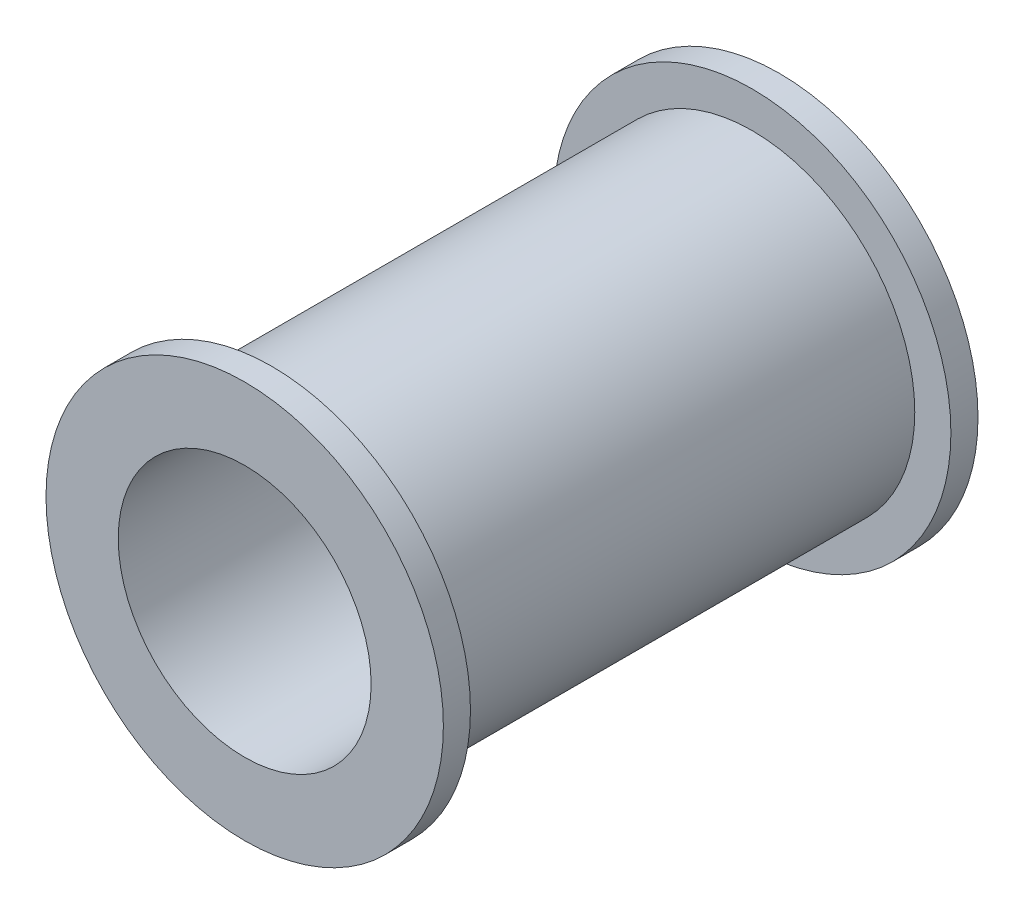
from build123d import *

# Parameters (mm, degrees)
CROQUIS1_R                 = 9
CROQUIS1_R_2               = 1.625
SALIENTE_EXTRUIR1_DEPTH    = 8.9
SALIENTE_EXTRUIR2_START    = 20.7
CROQUIS2_R                 = 9
CROQUIS2_R_2               = 7
SALIENTE_EXTRUIR2_DEPTH    = 20.7
CORTAR_EXTRUIR1_DEPTH      = 6.25
CORTAR_EXTRUIR2_DEPTH      = 7.25
CORTAR_EXTRUIR2_DEPTH_BACK = 4.25
CROQUIS4_R                 = 1.625
CROQUIS7_R                 = 11
CROQUIS7_R_2               = 7
SALIENTE_EXTRUIR3_DEPTH    = 1.5
SALIENTE_EXTRUIR4_START    = -1.5
CROQUIS8_R                 = 11
CROQUIS8_R_2               = 9
SALIENTE_EXTRUIR4_DEPTH    = 1.5


with BuildPart() as part:
    # Croquis1 → Saliente-Extruir1 (new body)
    with BuildSketch(Plane.XY):
        with Locations((-4.976335362, -25.8)):
            Circle(CROQUIS1_R)
        with Locations((-4.976335362, -25.8)):
            Circle(CROQUIS1_R_2, mode=Mode.SUBTRACT)
    extrude(amount=-SALIENTE_EXTRUIR1_DEPTH)

    # Croquis2 → Saliente-Extruir2 (add)
    with BuildSketch(Plane.XY.offset(SALIENTE_EXTRUIR2_START)):
        with Locations((-4.976335362, -25.8)):
            Circle(CROQUIS2_R)
        with Locations((-4.976335362, -25.8)):
            Circle(CROQUIS2_R_2, mode=Mode.SUBTRACT)
    extrude(amount=-SALIENTE_EXTRUIR2_DEPTH)

    # Croquis3 → Cortar-Extruir1 (cut)
    with BuildSketch(Plane(origin=(0, 0, -8.9), x_dir=(-1, 0, 0), z_dir=(0, 0, -1))):
        Polygon((8.146335362, -29.3), (8.146335362, -32.3), (1.806335362, -32.3), (1.806335362, -29.3), (4.976335362, -29.3), align=None)
    extrude(amount=-CORTAR_EXTRUIR1_DEPTH, mode=Mode.SUBTRACT)

    # Croquis4 → Cortar-Extruir2 (cut, two sides: drawn at the far end of the back side and taken through both)
    with BuildSketch(Plane.XZ.offset(29.3).offset(-CORTAR_EXTRUIR2_DEPTH_BACK)):
        with Locations(Location((-4.976335362, -5.775, 0), (0, 0, 90))):
            Circle(CROQUIS4_R)
    extrude(amount=CORTAR_EXTRUIR2_DEPTH + CORTAR_EXTRUIR2_DEPTH_BACK, mode=Mode.SUBTRACT)

    # Croquis7 → Saliente-Extruir3 (add)
    with BuildSketch(Plane.XY.offset(20.7)):
        with Locations((-4.976335362, -25.8)):
            Circle(CROQUIS7_R)
        with Locations((-4.976335362, -25.8)):
            Circle(CROQUIS7_R_2, mode=Mode.SUBTRACT)
    extrude(amount=-SALIENTE_EXTRUIR3_DEPTH)

    # Croquis8 → Saliente-Extruir4 (add)
    with BuildSketch(Plane(origin=(0, 0, -8.9), x_dir=(-1, 0, 0), z_dir=(0, 0, -1)).offset(SALIENTE_EXTRUIR4_START)):
        with Locations(Location((4.976335362, -25.8, 0), (0, 0, 180))):
            Circle(CROQUIS8_R)
        with Locations(Location((4.976335362, -25.8, 0), (0, 0, 180))):
            Circle(CROQUIS8_R_2, mode=Mode.SUBTRACT)
    extrude(amount=SALIENTE_EXTRUIR4_DEPTH)


solid = part.part
